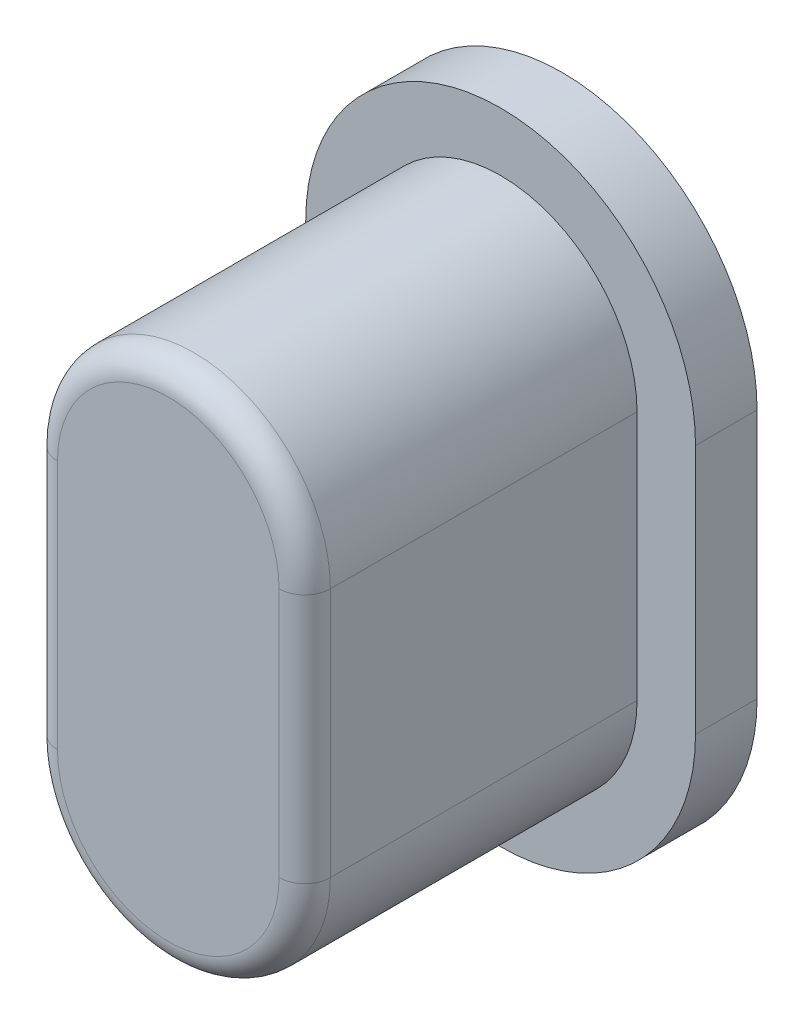
from build123d import *

# Parameters (mm, degrees)
BOSS_EXTRUDE1_DEPTH = 1.2
BOSS_EXTRUDE2_DEPTH = 6.48
FILLET1_R           = 0.5


with BuildPart() as part:
    # Sketch1 → Boss-Extrude1 (new body)
    with BuildSketch(Plane.XY):
        with BuildLine():
            Line((-3.8, -2.43766), (-3.8, 2.43766))
            ThreePointArc((-3.8, 2.43766), (0, 6.23766), (3.8, 2.43766))
            Line((3.8, 2.43766), (3.8, -2.43766))
            ThreePointArc((3.8, -2.43766), (0, -6.23766), (-3.8, -2.43766))
        make_face()
    extrude(amount=BOSS_EXTRUDE1_DEPTH)

    # Sketch2 → Boss-Extrude2 (add)
    with BuildSketch(Plane.XY.offset(1.2)):
        with BuildLine():
            Line((2.66, -2.43766), (2.66, 2.43766))
            ThreePointArc((2.66, 2.43766), (0, 5.09766), (-2.66, 2.43766))
            Line((-2.66, 2.43766), (-2.66, -2.43766))
            ThreePointArc((-2.66, -2.43766), (0, -5.09766), (2.66, -2.43766))
        make_face()
    extrude(amount=BOSS_EXTRUDE2_DEPTH)

    # Fillet1
    fillet1_edges = [part.edges().sort_by_distance(p)[0] for p in [
        (0, -5.09766, 7.68),
        (2.66, 0, 7.68),
        (0, 5.09766, 7.68),
        (-2.66, 0, 7.68),
    ]]
    fillet(fillet1_edges, radius=FILLET1_R)


solid = part.part
